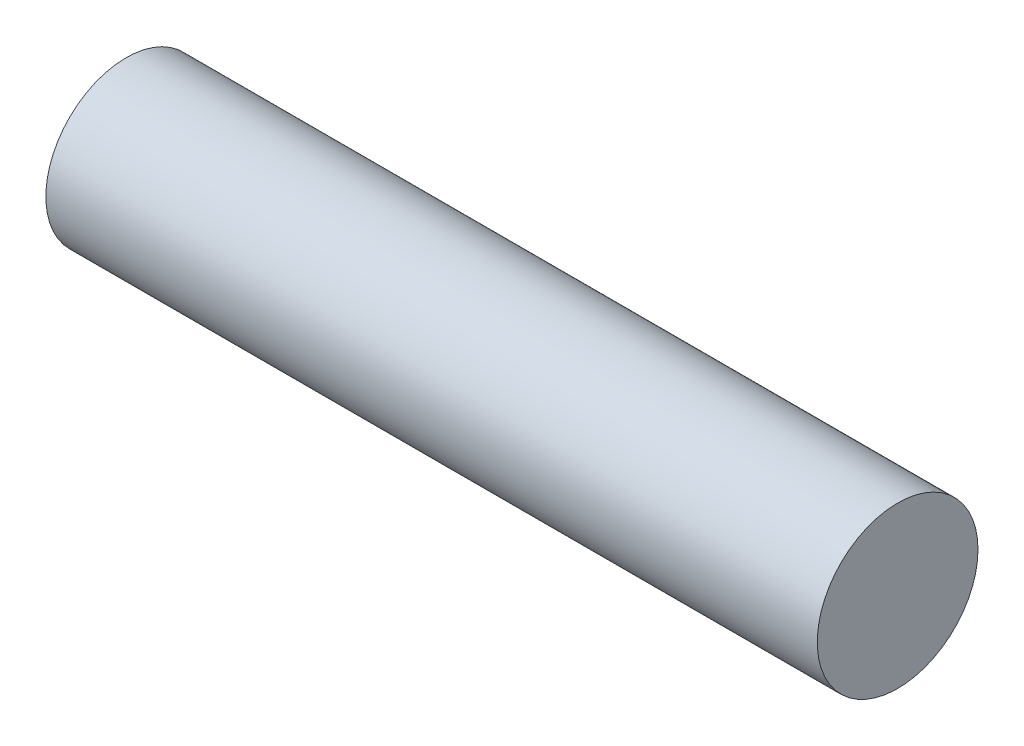
from build123d import *

# Parameters (mm, degrees)
SKETCH1_R           = 2.5
BOSS_EXTRUDE1_DEPTH = 12


with BuildPart() as part:
    # Sketch1 → Boss-Extrude1 (new, symmetric)
    with BuildSketch(Plane(origin=(0, 0, 0), x_dir=(0, 0, -1), z_dir=(1, 0, 0))):
        Circle(SKETCH1_R)
    extrude(amount=BOSS_EXTRUDE1_DEPTH, both=True)


solid = part.part
